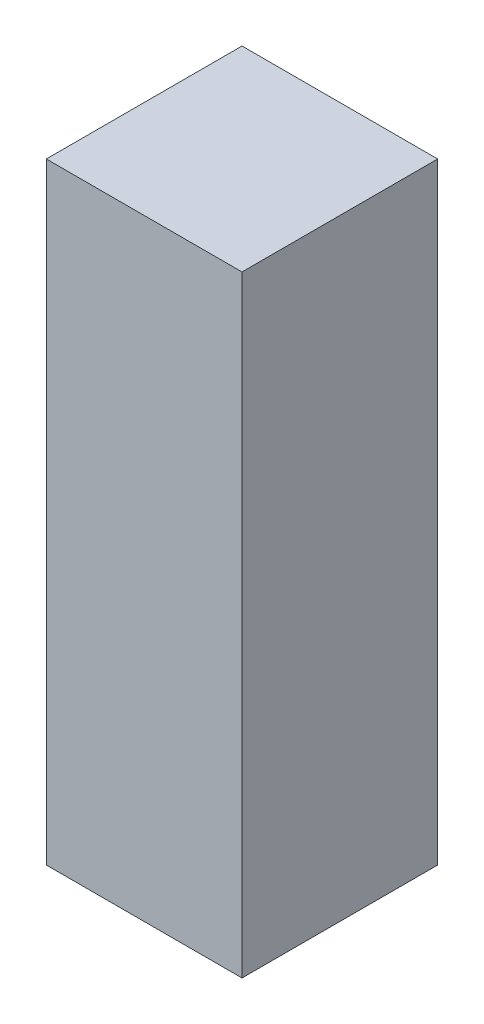
from build123d import *

# Parameters (mm, degrees)
SKETCH1_W           = 80
SKETCH1_H           = 80
BOSS_EXTRUDE1_DEPTH = 250


with BuildPart() as part:
    # Sketch1 → Boss-Extrude1 (new body)
    with BuildSketch(Plane(origin=(0, 0, 0), x_dir=(1, 0, 0), z_dir=(0, 1, 0))):
        with Locations((-11.725778547, 12.165198003)):
            Rectangle(SKETCH1_W, SKETCH1_H)
    extrude(amount=BOSS_EXTRUDE1_DEPTH)


solid = part.part
